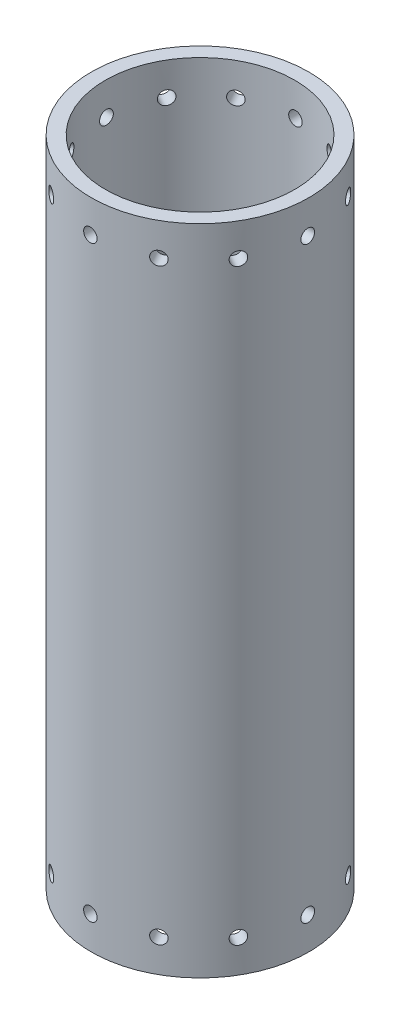
from build123d import *

# Parameters (mm, degrees)
SKETCH1_W         = 6.604
SKETCH1_H         = 304.8
CIRPATTERN1_COUNT = 12
LPATTERN1_COUNT   = 2
LPATTERN1_PITCH   = 274.32


with BuildPart() as part:
    # Sketch1 → Revolve1 (revolve)
    with BuildSketch(Plane.XY, mode=Mode.PRIVATE) as revolve1_sk:
        with Locations((47.498, 152.4)):
            Rectangle(SKETCH1_W, SKETCH1_H)
    revolve(revolve1_sk.sketch.rotate(Axis((0, 0, 0), (0, 1, 0)), 90), axis=Axis((0, 0, 0), (0, 1, 0)))

    # Sketch3 → E (0.25) Diameter Hole1 (revolve, cut)
    with BuildSketch(Plane(origin=(44.229964752, 289.56, -24.987000982), x_dir=(-0.4918700980639778, 0, -0.8706685974758324), z_dir=(0, 1, 0))):
        Polygon((0, 0), (0, 52.706732465), (3.175, 50.799), (3.175, 0), align=None)
    e_0_25_diameter_hole1 = revolve(axis=Axis((49.758710346, 289.56, -28.110376104), (-0.8706685974758324, 0, 0.4918700980639778)), mode=Mode.SUBTRACT)

    # CirPattern1: E (0.25) Diameter Hole1 ×12 about axis
    cirpattern1_axis = Axis((0, 304.8, 0), (0, -1, 0))
    for i in range(1, CIRPATTERN1_COUNT):
        add(e_0_25_diameter_hole1.rotate(cirpattern1_axis, i * 360 / CIRPATTERN1_COUNT), mode=Mode.SUBTRACT)

    # LPattern1: E (0.25) Diameter Hole1 ×2
    with Locations(*[(0, -i * LPATTERN1_PITCH, 0) for i in range(1, LPATTERN1_COUNT)]):
        add(e_0_25_diameter_hole1, mode=Mode.SUBTRACT)

    # LPattern1 copy 1 sketch → LPattern1 copy 1 (revolve, cut)
    with BuildSketch(Plane(origin=(50.797773574, 15.24, 0.475604761), x_dir=(0.009362298452568307, 0, -0.9999561727234276), z_dir=(0, 1, 0))):
        Polygon((0, 0), (0, 52.706732465), (3.175, 50.799), (3.175, 0), align=None)
    revolve(axis=Axis((57.147495271, 15.24, 0.535055357), (-0.9999561727234276, 0, -0.009362298452568307)), mode=Mode.SUBTRACT)

    # LPattern1 copy 2 sketch → LPattern1 copy 2 (revolve, cut)
    with BuildSketch(Plane(origin=(43.75435999, 15.24, 25.810772593), x_dir=(0.5080860746594497, 0, -0.861306299023264), z_dir=(0, 1, 0))):
        Polygon((0, 0), (0, 52.706732465), (3.175, 50.799), (3.175, 0), align=None)
    revolve(axis=Axis((49.223654989, 15.24, 29.037119167), (-0.861306299023264, 0, -0.5080860746594497)), mode=Mode.SUBTRACT)

    # LPattern1 copy 3 sketch → LPattern1 copy 3 (revolve, cut)
    with BuildSketch(Plane(origin=(24.987000982, 15.24, 44.229964752), x_dir=(0.8706685974758324, 0, -0.49187009806397786), z_dir=(0, 1, 0))):
        Polygon((0, 0), (0, 52.706732465), (3.175, 50.799), (3.175, 0), align=None)
    revolve(axis=Axis((28.110376104, 15.24, 49.758710346), (-0.49187009806397786, 0, -0.8706685974758324)), mode=Mode.SUBTRACT)

    # LPattern1 copy 4 sketch → LPattern1 copy 4 (revolve, cut)
    with BuildSketch(Plane(origin=(-0.475604761, 15.24, 50.797773574), x_dir=(0.9999561727234275, 0, 0.009362298452568196), z_dir=(0, 1, 0))):
        Polygon((0, 0), (0, 52.706732465), (3.175, 50.799), (3.175, 0), align=None)
    revolve(axis=Axis((-0.535055357, 15.24, 57.147495271), (0.009362298452568196, 0, -0.9999561727234275)), mode=Mode.SUBTRACT)

    # LPattern1 copy 5 sketch → LPattern1 copy 5 (revolve, cut)
    with BuildSketch(Plane(origin=(-25.810772593, 15.24, 43.75435999), x_dir=(0.8613062990232639, 0, 0.5080860746594498), z_dir=(0, 1, 0))):
        Polygon((0, 0), (0, 52.706732465), (3.175, 50.799), (3.175, 0), align=None)
    revolve(axis=Axis((-29.037119167, 15.24, 49.223654989), (0.5080860746594498, 0, -0.8613062990232639)), mode=Mode.SUBTRACT)

    # LPattern1 copy 6 sketch → LPattern1 copy 6 (revolve, cut)
    with BuildSketch(Plane(origin=(-44.229964752, 15.24, 24.987000982), x_dir=(0.4918700980639779, 0, 0.8706685974758323), z_dir=(0, 1, 0))):
        Polygon((0, 0), (0, 52.706732465), (3.175, 50.799), (3.175, 0), align=None)
    revolve(axis=Axis((-49.758710346, 15.24, 28.110376104), (0.8706685974758323, 0, -0.4918700980639779)), mode=Mode.SUBTRACT)

    # LPattern1 copy 7 sketch → LPattern1 copy 7 (revolve, cut)
    with BuildSketch(Plane(origin=(-50.797773574, 15.24, -0.475604761), x_dir=(-0.00936229845256853, 0, 0.9999561727234275), z_dir=(0, 1, 0))):
        Polygon((0, 0), (0, 52.706732465), (3.175, 50.799), (3.175, 0), align=None)
    revolve(axis=Axis((-57.147495271, 15.24, -0.535055357), (0.9999561727234275, 0, 0.00936229845256853)), mode=Mode.SUBTRACT)

    # LPattern1 copy 8 sketch → LPattern1 copy 8 (revolve, cut)
    with BuildSketch(Plane(origin=(-43.75435999, 15.24, -25.810772593), x_dir=(-0.5080860746594492, 0, 0.8613062990232643), z_dir=(0, 1, 0))):
        Polygon((0, 0), (0, 52.706732465), (3.175, 50.799), (3.175, 0), align=None)
    revolve(axis=Axis((-49.223654989, 15.24, -29.037119167), (0.8613062990232643, 0, 0.5080860746594492)), mode=Mode.SUBTRACT)

    # LPattern1 copy 9 sketch → LPattern1 copy 9 (revolve, cut)
    with BuildSketch(Plane(origin=(-24.987000982, 15.24, -44.229964752), x_dir=(-0.8706685974758323, 0, 0.49187009806397797), z_dir=(0, 1, 0))):
        Polygon((0, 0), (0, 52.706732465), (3.175, 50.799), (3.175, 0), align=None)
    revolve(axis=Axis((-28.110376104, 15.24, -49.758710346), (0.49187009806397797, 0, 0.8706685974758323)), mode=Mode.SUBTRACT)

    # LPattern1 copy 10 sketch → LPattern1 copy 10 (revolve, cut)
    with BuildSketch(Plane(origin=(0.475604761, 15.24, -50.797773574), x_dir=(-0.9999561727234275, 0, -0.00936229845256853), z_dir=(0, 1, 0))):
        Polygon((0, 0), (0, 52.706732465), (3.175, 50.799), (3.175, 0), align=None)
    revolve(axis=Axis((0.535055357, 15.24, -57.147495271), (-0.00936229845256853, 0, 0.9999561727234275)), mode=Mode.SUBTRACT)

    # LPattern1 copy 11 sketch → LPattern1 copy 11 (revolve, cut)
    with BuildSketch(Plane(origin=(25.810772593, 15.24, -43.75435999), x_dir=(-0.8613062990232643, 0, -0.5080860746594492), z_dir=(0, 1, 0))):
        Polygon((0, 0), (0, 52.706732465), (3.175, 50.799), (3.175, 0), align=None)
    revolve(axis=Axis((29.037119167, 15.24, -49.223654989), (-0.5080860746594492, 0, 0.8613062990232643)), mode=Mode.SUBTRACT)


solid = part.part
